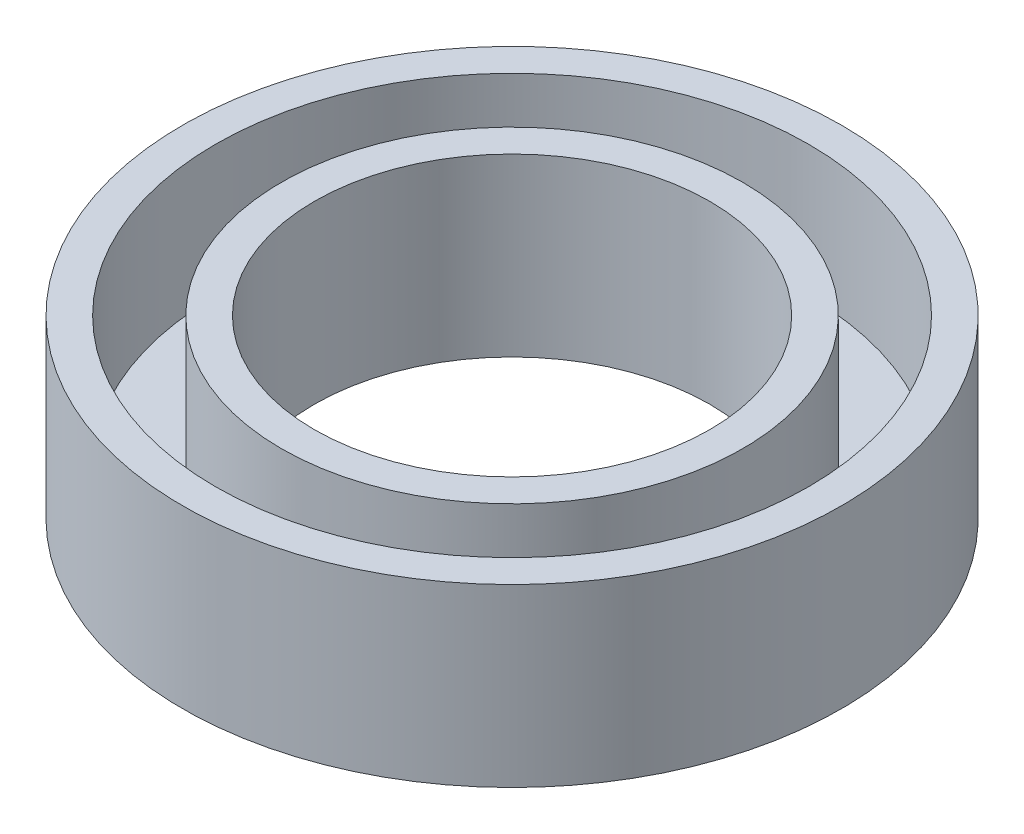
from build123d import *


with BuildPart() as part:
    # 草图1 → 旋转1 (revolve)
    with BuildSketch(Plane.XY, mode=Mode.PRIVATE) as revolve_1_sk:
        Polygon((-13.5, 2), (-13.5, 8), (-15, 8), (-15, 0), (-9, 0), (-9, 8), (-10.5, 8), (-10.5, 2), align=None)
    revolve(revolve_1_sk.sketch.rotate(Axis((0, 0, 0), (0, 1, 0)), 270), axis=Axis((0, 0, 0), (0, 1, 0)))


solid = part.part
